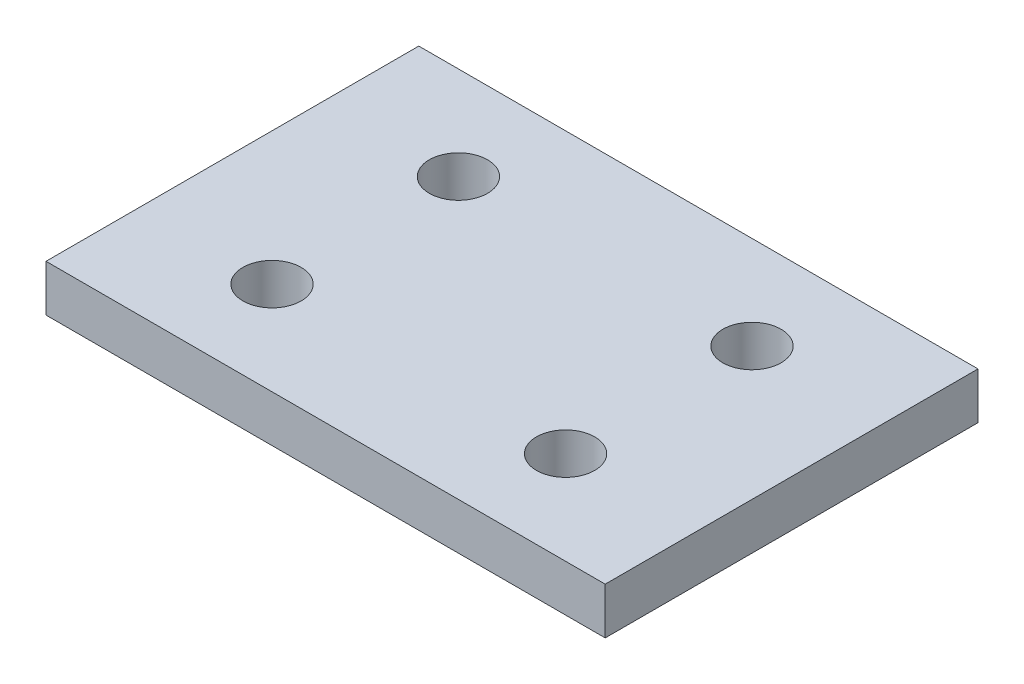
from build123d import *

# Parameters (mm, degrees)
SKETCH1_W           = 76.2
SKETCH1_H           = 50.8
BOSS_EXTRUDE1_DEPTH = 6.35
SKETCH3_R           = 3.96875
CUT_EXTRUDE1_DEPTH  = 92.800885072


with BuildPart() as part:
    # Sketch1 → Boss-Extrude1 (new body)
    with BuildSketch(Plane(origin=(0, 0, 0), x_dir=(1, 0, 0), z_dir=(0, 1, 0))):
        with Locations((38.1, 25.4)):
            Rectangle(SKETCH1_W, SKETCH1_H)
    extrude(amount=BOSS_EXTRUDE1_DEPTH)

    # Sketch3 → Cut-Extrude1 (cut, through all)
    with BuildSketch(Plane(origin=(0, 6.35, 0), x_dir=(1, 0, 0), z_dir=(0, 1, 0))):
        with Locations(Location((18.1, 38.1, 0), (0, 0, 270))):
            Circle(SKETCH3_R)
        with Locations(Location((18.1, 12.7, 0), (0, 0, 270))):
            Circle(SKETCH3_R)
        with Locations(Location((58.1, 38.1, 0), (0, 0, 270))):
            Circle(SKETCH3_R)
        with Locations(Location((58.1, 12.7, 0), (0, 0, 270))):
            Circle(SKETCH3_R)
    extrude(amount=-CUT_EXTRUDE1_DEPTH, mode=Mode.SUBTRACT)


solid = part.part
